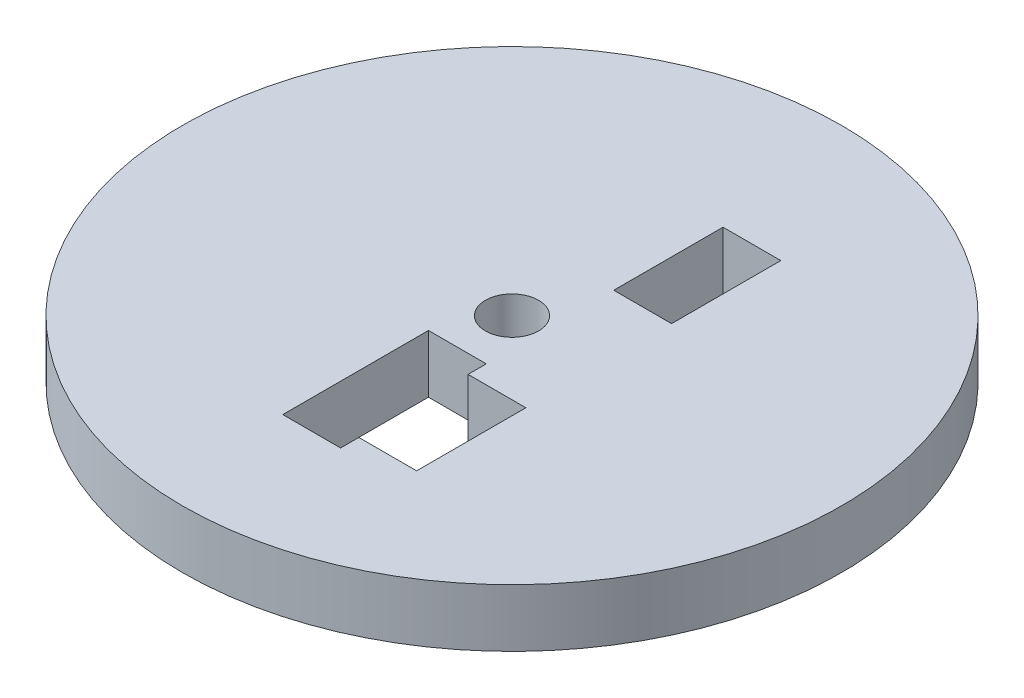
from build123d import *

# Parameters (mm, degrees)
SKETCH1_R           = 18.0975
SKETCH1_R_2         = 1.4605
SKETCH1_W           = 3.175
SKETCH1_H           = 6
BOSS_EXTRUDE1_DEPTH = 3.175


with BuildPart() as part:
    # Sketch1 → Boss-Extrude1 (new body)
    with BuildSketch(Plane(origin=(0, 0, 0), x_dir=(1, 0, 0), z_dir=(0, 1, 0))):
        with Locations(Location((0, 0, 0), (0, 0, 270))):
            Circle(SKETCH1_R)
        with Locations(Location((0, 0, 0), (0, 0, 270))):
            Circle(SKETCH1_R_2, mode=Mode.SUBTRACT)
        Polygon((1.5875, -4), (1.5875, -3), (-1.5875, -3), (-1.5875, -11), (1.5875, -11), (1.5875, -10), (4.7625, -10), (4.7625, -4), align=None, mode=Mode.SUBTRACT)
        with Locations((3.175, 7)):
            Rectangle(SKETCH1_W, SKETCH1_H, mode=Mode.SUBTRACT)
    extrude(amount=BOSS_EXTRUDE1_DEPTH)


solid = part.part
